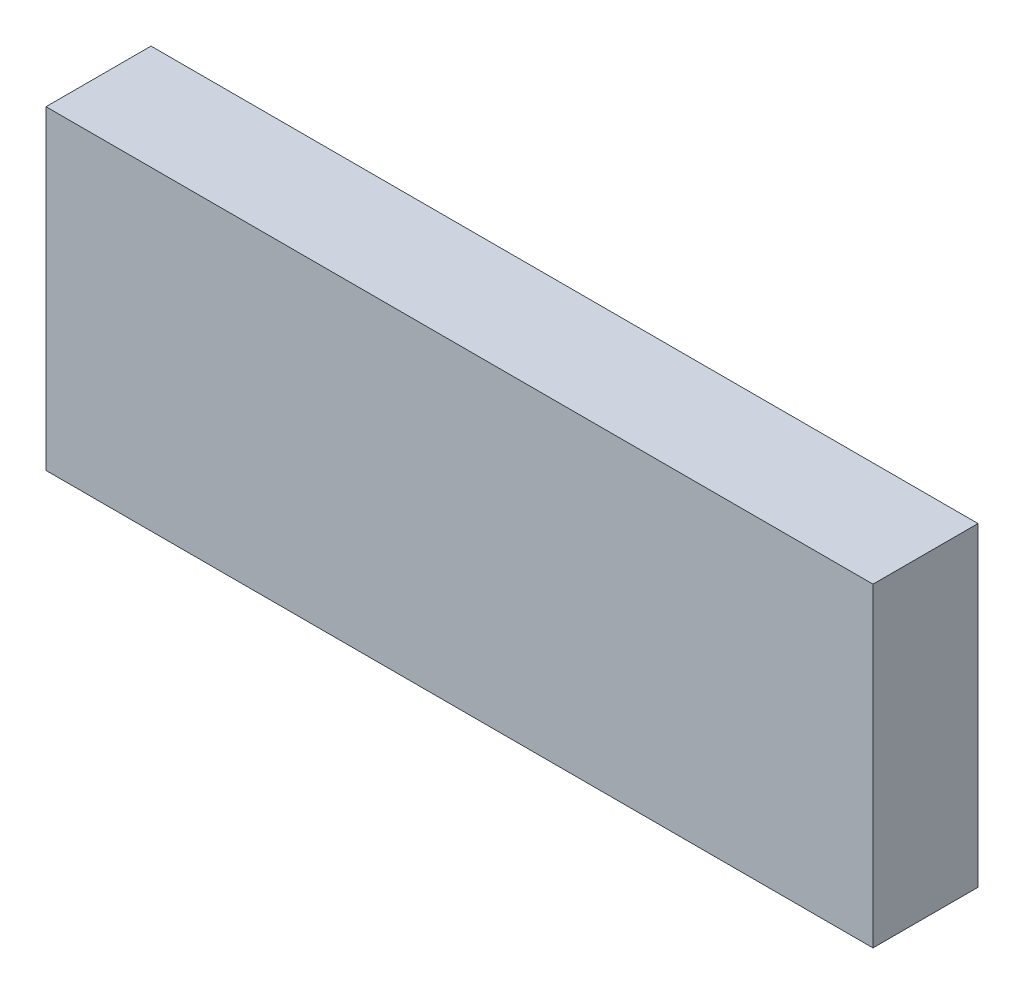
from build123d import *

# Parameters (mm, degrees)
SKETCH1_W           = 20
SKETCH1_H           = 60
BOSS_EXTRUDE1_DEPTH = 157.5


with BuildPart() as part:
    # Sketch1 → Boss-Extrude1 (new body)
    with BuildSketch(Plane(origin=(0, 0, 0), x_dir=(0, 0, -1), z_dir=(1, 0, 0))):
        Rectangle(SKETCH1_W, SKETCH1_H)
    extrude(amount=BOSS_EXTRUDE1_DEPTH)


solid = part.part
